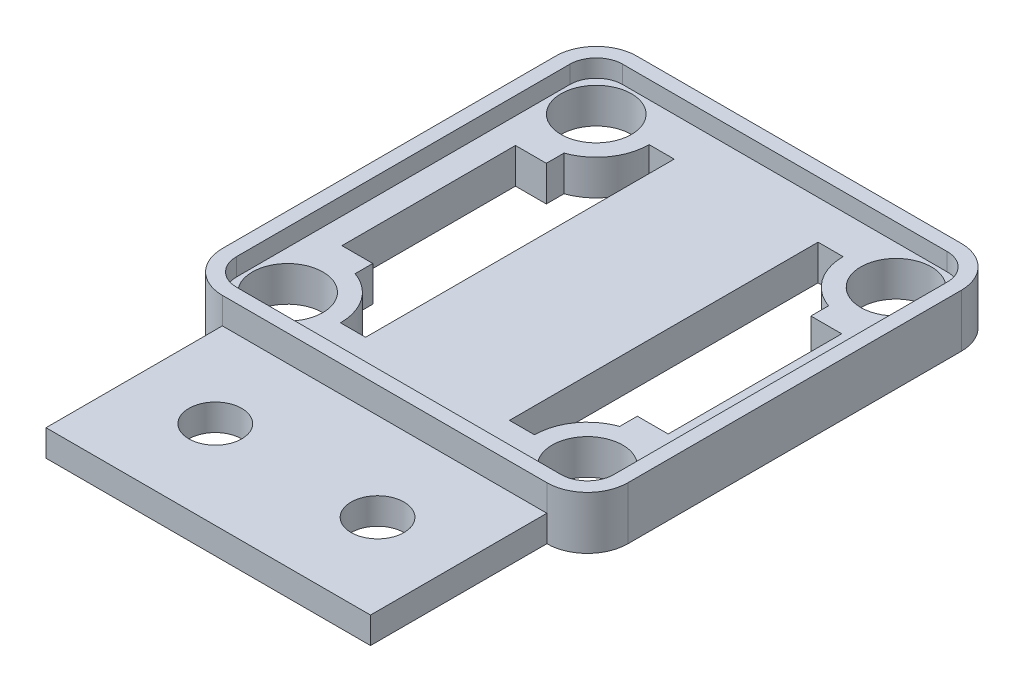
from build123d import *

# Parameters (mm, degrees)
BOSS_EXTRUDE1_DEPTH = 3
CUT_EXTRUDE2_DEPTH  = 1
SKETCH5_R           = 2
CUT_EXTRUDE3_DEPTH  = 22.014339996
CUT_EXTRUDE4_DEPTH  = 22.014339996
SKETCH7_W           = 18.4
SKETCH7_H           = 1.5
BOSS_EXTRUDE2_DEPTH = 10
SKETCH8_R           = 1.5
CUT_EXTRUDE5_DEPTH  = 25.118139675
CUT_EXTRUDE6_DEPTH  = 1
SKETCH11_W          = 1.421057218
SKETCH11_H          = 17.5
SKETCH11_W_2        = 1.75
SKETCH11_H_2        = 9.84
CUT_EXTRUDE7_DEPTH  = 25.154392176


with BuildPart() as part:
    # Sketch1 → Boss-Extrude1 (new body)
    with BuildSketch(Plane(origin=(0, 0, 0), x_dir=(1, 0, 0), z_dir=(0, 1, 0))):
        with BuildLine():
            Line((-12.649074074, 14.633101852), (5.750925926, 14.633101852))
            ThreePointArc((5.750925926, 14.633101852), (7.377271523, 13.959447449), (8.050925926, 12.333101852))
            Line((8.050925926, 12.333101852), (8.050925926, -6.566898148))
            ThreePointArc((8.050925926, -6.566898148), (7.377271523, -8.193243745), (5.750925926, -8.866898148))
            Line((5.750925926, -8.866898148), (-12.649074074, -8.866898148))
            ThreePointArc((-12.649074074, -8.866898148), (-14.275419671, -8.193243745), (-14.949074074, -6.566898148))
            Line((-14.949074074, -6.566898148), (-14.949074074, 12.333101852))
            ThreePointArc((-14.949074074, 12.333101852), (-14.275419671, 13.959447449), (-12.649074074, 14.633101852))
        make_face()
    extrude(amount=BOSS_EXTRUDE1_DEPTH)

    # Sketch2 → Cut-Extrude2 (cut)
    with BuildSketch(Plane(origin=(0, 3, 0), x_dir=(1, 0, 0), z_dir=(0, 1, 0))):
        with BuildLine():
            Line((5.750925926, 13.633101852), (-12.649074074, 13.633101852))
            ThreePointArc((-12.649074074, 13.633101852), (-13.56831289, 13.252340667), (-13.949074074, 12.333101852))
            Line((-13.949074074, 12.333101852), (-13.949074074, -6.566898148))
            ThreePointArc((-13.949074074, -6.566898148), (-13.56831289, -7.486136964), (-12.649074074, -7.866898148))
            Line((-12.649074074, -7.866898148), (5.750925926, -7.866898148))
            ThreePointArc((5.750925926, -7.866898148), (6.670164741, -7.486136964), (7.050925926, -6.566898148))
            Line((7.050925926, -6.566898148), (7.050925926, 12.333101852))
            ThreePointArc((7.050925926, 12.333101852), (6.670164741, 13.252340667), (5.750925926, 13.633101852))
        make_face()
    extrude(amount=-CUT_EXTRUDE2_DEPTH, mode=Mode.SUBTRACT)

    # Sketch5 → Cut-Extrude3 (cut, through all)
    with BuildSketch(Plane(origin=(0, 2, 0), x_dir=(1, 0, 0), z_dir=(0, 1, 0))):
        with Locations(Location((5.050925926, 11.633101852, 0), (0, 0, 270))):
            Circle(SKETCH5_R)
        with Locations(Location((5.050925926, -5.866898148, 0), (0, 0, 270))):
            Circle(SKETCH5_R)
        with Locations(Location((-11.949074074, -5.866898148, 0), (0, 0, 270))):
            Circle(SKETCH5_R)
        with Locations(Location((-11.949074074, 11.633101852, 0), (0, 0, 90))):
            Circle(SKETCH5_R)
    extrude(amount=-CUT_EXTRUDE3_DEPTH, mode=Mode.SUBTRACT)

    # Sketch6 → Cut-Extrude4 (cut, through all)
    with BuildSketch(Plane(origin=(0, 2, 0), x_dir=(1, 0, 0), z_dir=(0, 1, 0))):
        with BuildLine():
            Line((4.050925926, -3.038471023), (4.050925926, 8.804674727))
            ThreePointArc((4.050925926, 8.804674727), (2.601436183, 9.901051044), (2.050925926, 11.633101852))
            Line((2.050925926, 11.633101852), (2.050925926, -5.866898148))
            ThreePointArc((2.050925926, -5.866898148), (2.601436183, -4.134847341), (4.050925926, -3.038471023))
        make_face()
        with BuildLine():
            Line((-10.949074074, 8.804674727), (-10.949074074, -3.038471023))
            ThreePointArc((-10.949074074, -3.038471023), (-9.499584331, -4.134847341), (-8.949074074, -5.866898148))
            Line((-8.949074074, -5.866898148), (-8.949074074, 11.633101852))
            ThreePointArc((-8.949074074, 11.633101852), (-9.499584331, 9.901051044), (-10.949074074, 8.804674727))
        make_face()
    extrude(amount=-CUT_EXTRUDE4_DEPTH, mode=Mode.SUBTRACT)

    # Sketch7 → Boss-Extrude2 (add)
    with BuildSketch(Plane.XY.offset(8.866898148)):
        with Locations((-3.449074074, 0.75)):
            Rectangle(SKETCH7_W, SKETCH7_H)
    extrude(amount=BOSS_EXTRUDE2_DEPTH)

    # Sketch8 → Cut-Extrude5 (cut, through all)
    with BuildSketch(Plane(origin=(0, 1.5, 0), x_dir=(1, 0, 0), z_dir=(0, 1, 0))):
        with Locations(Location((1.150925926, -13.866898148, 0), (0, 0, 270))):
            Circle(SKETCH8_R)
        with Locations(Location((-8.049074074, -13.866898148, 0), (0, 0, 270))):
            Circle(SKETCH8_R)
    extrude(amount=-CUT_EXTRUDE5_DEPTH, mode=Mode.SUBTRACT)

    # Sketch9 → Cut-Extrude6 (cut)
    with BuildSketch(Plane(origin=(0, 3, 0), x_dir=(1, 0, 0), z_dir=(0, 1, 0))):
        with BuildLine():
            Line((5.750925926, 13.833101852), (-12.649074074, 13.833101852))
            ThreePointArc((-12.649074074, 13.833101852), (-13.709734246, 13.393762024), (-14.149074074, 12.333101852))
            Line((-14.149074074, 12.333101852), (-14.149074074, -6.566898148))
            ThreePointArc((-14.149074074, -6.566898148), (-13.709734246, -7.62755832), (-12.649074074, -8.066898148))
            Line((-12.649074074, -8.066898148), (5.750925926, -8.066898148))
            ThreePointArc((5.750925926, -8.066898148), (6.811586098, -7.62755832), (7.250925926, -6.566898148))
            Line((7.250925926, -6.566898148), (7.250925926, 12.333101852))
            ThreePointArc((7.250925926, 12.333101852), (6.811586098, 13.393762024), (5.750925926, 13.833101852))
        make_face()
    extrude(amount=-CUT_EXTRUDE6_DEPTH, mode=Mode.SUBTRACT)

    # Sketch11 → Cut-Extrude7 (cut, through all)
    with BuildSketch(Plane(origin=(0, 2, 0), x_dir=(1, 0, 0), z_dir=(0, 1, 0))):
        with Locations((-8.238545465, 2.883101852)):
            Rectangle(SKETCH11_W, SKETCH11_H)
        with Locations((1.340397317, 2.883101852)):
            Rectangle(SKETCH11_W, SKETCH11_H)
        with Locations((-11.824074074, 2.883101852)):
            Rectangle(SKETCH11_W_2, SKETCH11_H_2)
        with Locations((4.925925926, 2.883101852)):
            Rectangle(SKETCH11_W_2, SKETCH11_H_2)
    extrude(amount=-CUT_EXTRUDE7_DEPTH, mode=Mode.SUBTRACT)


solid = part.part
